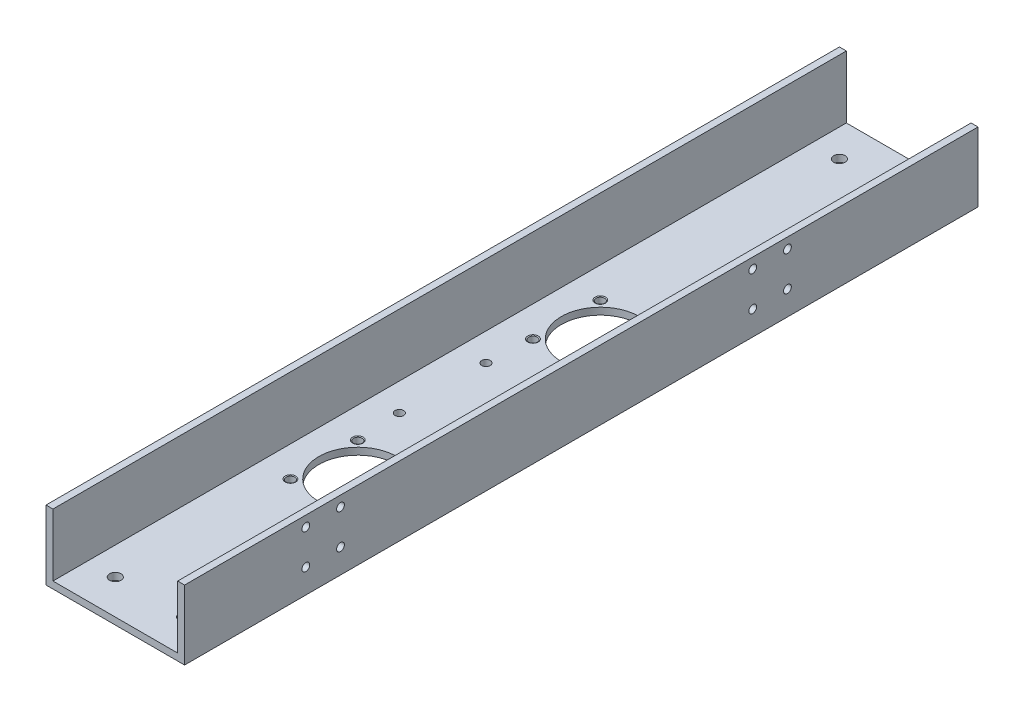
from build123d import *

# Parameters (mm, degrees)
EXTRUDE_1_DEPTH             = 298
SKETCH_2_R                  = 22.5
CUT_EXTRUDE_1_DEPTH         = 312.133411899
HOLE_WIZARD_M62_D           = 5
HOLE_WIZARD_M62_DEPTH       = 17
HOLE_WIZARD_M62_CSINK_D     = 6.05
HOLE_WIZARD_M62_CSINK_ANGLE = 120
HOLE_WIZARD_M62_TIP         = 1.502151548
HOLE_WIZARD_M42_D           = 4.5
HOLE_WIZARD_M42_DEPTH       = 5
HOLE_WIZARD_M42_TIP         = 1.351936393
HOLE_WIZARD_M63_D           = 5
HOLE_WIZARD_M63_DEPTH       = 17
HOLE_WIZARD_M63_CSINK_D     = 6.05
HOLE_WIZARD_M63_CSINK_ANGLE = 120
HOLE_WIZARD_M63_TIP         = 1.502151548
EXTRUDE_2_DEPTH             = 60
EXTRUDE_3_DEPTH             = 100
HOLE_WIZARD_M61_D           = 6.6
HOLE_WIZARD_M61_DEPTH       = 5
HOLE_WIZARD_M61_TIP         = 1.982840043


with BuildPart() as part:
    # Эскиз1 → Бобышка-Вытянуть1 (new body)
    with BuildSketch(Plane.XY):
        Polygon((0, 0), (0, 40), (4, 40), (4, 4), (76, 4), (76, 40), (80, 40), (80, 0), align=None)
    extrude(amount=EXTRUDE_1_DEPTH)

    # Эскиз2 → Вырез-Вытянуть1 (cut, through all)
    with BuildSketch(Plane.XZ):
        with Locations((41, 219)):
            Circle(SKETCH_2_R)
        with Locations((41, 79)):
            Circle(SKETCH_2_R)
    extrude(amount=-CUT_EXTRUDE_1_DEPTH, mode=Mode.SUBTRACT)

    # Отверстие обработанное метчиком M62
    with Locations(Plane(origin=(0, 4, 0), x_dir=(-1, 0, 0), z_dir=(0, 1, 0))):
        with Locations((-21.554563517, 98.445436483), (-21.554563517, 59.554563517), (-60.445436483, 59.554563517), (-60.445436483, 98.445436483), (-60.445436483, 199.554563517), (-60.445436483, 238.445436483), (-21.554563517, 238.445436483), (-21.554563517, 199.554563517)):
            CounterSinkHole(HOLE_WIZARD_M62_D / 2, HOLE_WIZARD_M62_CSINK_D / 2, depth=HOLE_WIZARD_M62_DEPTH, counter_sink_angle=HOLE_WIZARD_M62_CSINK_ANGLE)
            with Locations((0, 0, -(HOLE_WIZARD_M62_DEPTH + HOLE_WIZARD_M62_TIP / 2))):  # 118° drill point
                Cone(0, HOLE_WIZARD_M62_D / 2, HOLE_WIZARD_M62_TIP, mode=Mode.SUBTRACT)

    # Отверстие с зазором M42
    with Locations(Plane(origin=(80, 0, 0), x_dir=(0, 0, -1), z_dir=(1, 0, 0))):
        with Locations((-288, 34), (-30, 34), (-268, 34), (-10, 34), (-288, 14), (-30, 14), (-268, 14), (-10, 14)):
            Hole(HOLE_WIZARD_M42_D / 2, depth=HOLE_WIZARD_M42_DEPTH)
            with Locations((0, 0, -(HOLE_WIZARD_M42_DEPTH + HOLE_WIZARD_M42_TIP / 2))):  # 118° drill point
                Cone(0, HOLE_WIZARD_M42_D / 2, HOLE_WIZARD_M42_TIP, mode=Mode.SUBTRACT)

    # Отверстие обработанное метчиком M63
    with Locations(Plane.XZ):
        with Locations((20, 124), (20, 174), (60, 174), (60, 124)):
            CounterSinkHole(HOLE_WIZARD_M63_D / 2, HOLE_WIZARD_M63_CSINK_D / 2, depth=HOLE_WIZARD_M63_DEPTH, counter_sink_angle=HOLE_WIZARD_M63_CSINK_ANGLE)
            with Locations((0, 0, -(HOLE_WIZARD_M63_DEPTH + HOLE_WIZARD_M63_TIP / 2))):  # 118° drill point
                Cone(0, HOLE_WIZARD_M63_D / 2, HOLE_WIZARD_M63_TIP, mode=Mode.SUBTRACT)

    # Эскиз15 → Бобышка-Вытянуть2 (add)
    with BuildSketch(Plane.XY.offset(298)):
        Polygon((4, 4), (4, 40), (0, 40), (0, 0), (80, 0), (80, 40), (76, 40), (76, 4), align=None)
    extrude(amount=EXTRUDE_2_DEPTH)

    # Эскиз17 → Бобышка-Вытянуть3 (add)
    with BuildSketch(Plane(origin=(0, 0, 0), x_dir=(-1, 0, 0), z_dir=(0, 0, -1))):
        Polygon((-4, 4), (-4, 40), (0, 40), (0, 0), (-80, 0), (-80, 40), (-76, 40), (-76, 4), align=None)
    extrude(amount=EXTRUDE_3_DEPTH)

    # Отверстие с зазором M61
    with Locations(Plane(origin=(0, 4, 0), x_dir=(-1, 0, 0), z_dir=(0, 1, 0))):
        with Locations((-20, 338), (-60, 338), (-60, -80), (-20, -80)):
            Hole(HOLE_WIZARD_M61_D / 2, depth=HOLE_WIZARD_M61_DEPTH)
            with Locations((0, 0, -(HOLE_WIZARD_M61_DEPTH + HOLE_WIZARD_M61_TIP / 2))):  # 118° drill point
                Cone(0, HOLE_WIZARD_M61_D / 2, HOLE_WIZARD_M61_TIP, mode=Mode.SUBTRACT)


solid = part.part
